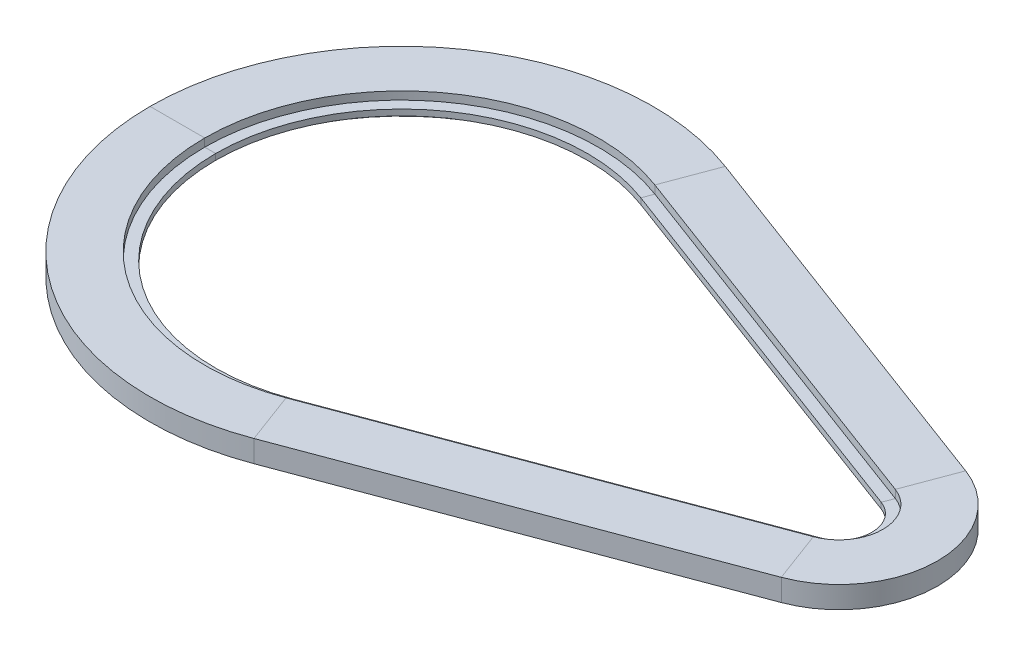
from build123d import *


with BuildPart() as part:
    # Sweep1: sweep along a path in Sketch2
    with BuildLine(Plane(origin=(0, 0, 0), x_dir=(1, 0, 0), z_dir=(0, 1, 0))) as sweep1_path:
        Line((131.445, 11.896721187), (20.0025, 53.535245341))
        ThreePointArc((20.0025, 53.535245341), (-57.15, 0), (20.0025, -53.535245341))
        Line((20.0025, -53.535245341), (131.445, -11.896721187))
        ThreePointArc((131.445, -11.896721187), (139.7, 0), (131.445, 11.896721187))
    # Sketch3 → Sweep1 (sweep)
    with BuildSketch(Plane.XY):
        Polygon((-57.15, 3.175), (-73.025, 3.175), (-73.025, -3.175), (-57.15, -3.175), (-57.15, -0.8636), (-53.975, -0.8636), (-53.975, 0.8636), (-57.15, 0.8636), align=None)
    sweep(path=sweep1_path.line)


solid = part.part
